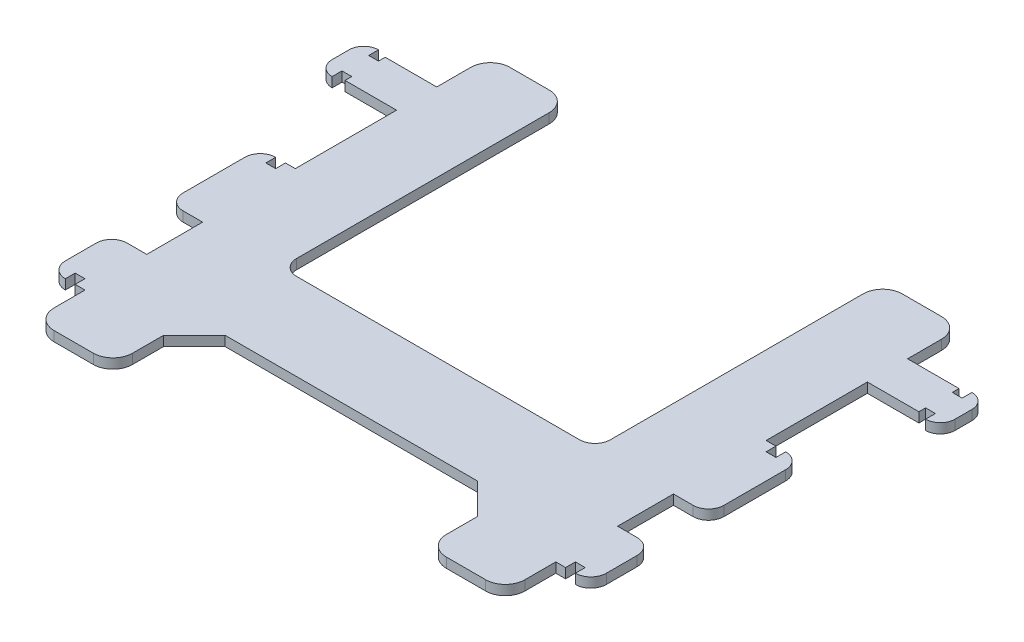
from build123d import *

# Parameters (mm, degrees)
SKETCH1_W           = 196.85
SKETCH1_H           = 120
BOSS_EXTRUDE1_DEPTH = 3.175
SKETCH2_W           = 152.4
SKETCH2_H           = 2.188710325
SKETCH2_W_2         = 3.175
SKETCH2_H_2         = 3.175
CUT_EXTRUDE3_DEPTH  = 3.175
BOSS_EXTRUDE3_DEPTH = 3.175
CUT_EXTRUDE5_DEPTH  = 6.175
BOSS_EXTRUDE4_DEPTH = 3.175
SKETCH8_W           = 16.66875
SKETCH8_H           = 1
CUT_EXTRUDE6_DEPTH  = 4
SKETCH9_W           = 16.66875
SKETCH9_H           = 1
CUT_EXTRUDE7_DEPTH  = 4


with BuildPart() as part:
    # Sketch1 → Boss-Extrude1 (new body)
    with BuildSketch(Plane(origin=(0, 0, 0), x_dir=(1, 0, 0), z_dir=(0, 1, 0))):
        Rectangle(SKETCH1_W, SKETCH1_H)
    extrude(amount=BOSS_EXTRUDE1_DEPTH)

    # Sketch2 → Cut-Extrude3 (cut)
    with BuildSketch(Plane(origin=(0, 0, 0), x_dir=(1, 0, 0), z_dir=(0, 1, 0))):
        with BuildLine():
            ThreePointArc((-87.55, -42.045183145), (-86.085533906, -38.509649239), (-82.55, -37.045183145))
            Line((-82.55, -37.045183145), (-98.425, -37.045183145))
            Line((-98.425, -37.045183145), (-98.425, -57.045183145))
            Line((-98.425, -57.045183145), (-82.55, -57.045183145))
            ThreePointArc((-82.55, -57.045183145), (-86.085533906, -55.580717051), (-87.55, -52.045183145))
            Line((-87.55, -52.045183145), (-87.55, -42.045183145))
        make_face()
        Polygon((-82.55, -37.045183145), (-76.2, -37.045183145), (-76.2, -18.966736095), (-82.55, -18.966736095), (-98.425, -18.966736095), (-98.425, -37.045183145), align=None)
        with BuildLine():
            Line((-98.425, -18.966736095), (-82.55, -18.966736095))
            ThreePointArc((-82.55, -18.966736095), (-86.085533906, -17.502270001), (-87.55, -13.966736095))
            Line((-87.55, -13.966736095), (-87.55, 6.033263905))
            ThreePointArc((-87.55, 6.033263905), (-86.085533906, 9.568797811), (-82.55, 11.033263905))
            Line((-82.55, 11.033263905), (-98.425, 11.033263905))
            Line((-98.425, 11.033263905), (-98.425, -18.966736095))
        make_face()
        with BuildLine():
            Line((-76.2, 11.033263905), (-76.2, 42.808053265))
            Line((-76.2, 42.808053265), (-92.86875, 42.808053265))
            Line((-92.86875, 42.808053265), (-96.04375, 42.808053265))
            ThreePointArc((-96.04375, 42.808053265), (-97.276375702, 42.970331517), (-98.425, 43.44610728))
            Line((-98.425, 43.44610728), (-98.425, 11.033263905))
            Line((-98.425, 11.033263905), (-82.55, 11.033263905))
            Line((-82.55, 11.033263905), (-79.375, 11.033263905))
            Line((-79.375, 11.033263905), (-76.2, 11.033263905))
        make_face()
        with BuildLine():
            Line((-92.86875, 57.811289675), (-76.2, 57.811289675))
            Line((-76.2, 57.811289675), (-76.2, 60))
            Line((-76.2, 60), (-98.425, 60))
            Line((-98.425, 60), (-98.425, 57.173235661))
            ThreePointArc((-98.425, 57.173235661), (-97.276375702, 57.649011423), (-96.04375, 57.811289675))
            Line((-96.04375, 57.811289675), (-92.86875, 57.811289675))
        make_face()
        with Locations((0, 58.905644838)):
            Rectangle(SKETCH2_W, SKETCH2_H)
        with BuildLine():
            Line((76.2, 60), (76.2, 57.811289675))
            Line((76.2, 57.811289675), (92.86875, 57.811289675))
            Line((92.86875, 57.811289675), (92.86875, 54.636289675))
            Line((92.86875, 54.636289675), (96.04375, 54.636289675))
            Line((96.04375, 54.636289675), (96.04375, 57.811289675))
            ThreePointArc((96.04375, 57.811289675), (97.276375702, 57.649011423), (98.425, 57.173235661))
            Line((98.425, 57.173235661), (98.425, 60))
            Line((98.425, 60), (76.2, 60))
        make_face()
        with BuildLine():
            Line((79.375, -18.966736095), (76.2, -18.966736095))
            Line((76.2, -18.966736095), (76.2, -37.045183145))
            Line((76.2, -37.045183145), (82.55, -37.045183145))
            ThreePointArc((82.55, -37.045183145), (86.085533906, -38.509649239), (87.55, -42.045183145))
            Line((87.55, -42.045183145), (87.55, -52.045183145))
            ThreePointArc((87.55, -52.045183145), (86.085533906, -55.580717051), (82.55, -57.045183145))
            Line((82.55, -57.045183145), (82.55, -53.870183145))
            Line((82.55, -53.870183145), (79.375, -53.870183145))
            Line((79.375, -53.870183145), (79.375, -57.045183145))
            Line((79.375, -57.045183145), (76.2, -57.045183145))
            Line((76.2, -57.045183145), (76.2, -59.23389347))
            Line((76.2, -59.23389347), (76.2, -60))
            Line((76.2, -60), (98.425, -60))
            Line((98.425, -60), (98.425, 0))
            Line((98.425, 0), (98.425, 43.44610728))
            ThreePointArc((98.425, 43.44610728), (97.276375702, 42.970331517), (96.04375, 42.808053265))
            Line((96.04375, 42.808053265), (96.04375, 45.983053265))
            Line((96.04375, 45.983053265), (92.86875, 45.983053265))
            Line((92.86875, 45.983053265), (92.86875, 42.808053265))
            Line((92.86875, 42.808053265), (87.3125, 42.808053265))
            Line((87.3125, 42.808053265), (76.2, 42.808053265))
            Line((76.2, 42.808053265), (76.2, 11.033263905))
            Line((76.2, 11.033263905), (79.375, 11.033263905))
            Line((79.375, 11.033263905), (79.375, 7.858263905))
            Line((79.375, 7.858263905), (82.55, 7.858263905))
            Line((82.55, 7.858263905), (82.55, 11.033263905))
            ThreePointArc((82.55, 11.033263905), (86.085533906, 9.568797811), (87.55, 6.033263905))
            Line((87.55, 6.033263905), (87.55, -13.966736095))
            ThreePointArc((87.55, -13.966736095), (86.085533906, -17.502270001), (82.55, -18.966736095))
            Line((82.55, -18.966736095), (79.375, -18.966736095))
        make_face()
        Polygon((76.2, -59.23389347), (76.2, -57.045183145), (-76.2, -57.045183145), (-76.2, -59.23389347), (-76.2, -60), (76.2, -60), align=None)
        Polygon((-76.2, -59.23389347), (-76.2, -57.045183145), (-79.375, -57.045183145), (-82.55, -57.045183145), (-98.425, -57.045183145), (-98.425, -60), (-76.2, -60), align=None)
        with Locations((-80.9625, -55.457683145)):
            Rectangle(SKETCH2_W_2, SKETCH2_H_2)
        with Locations((-80.9625, 9.445763905)):
            Rectangle(SKETCH2_W_2, SKETCH2_H_2)
        with Locations((-94.45625, 44.395553265)):
            Rectangle(SKETCH2_W_2, SKETCH2_H_2)
        with Locations((-94.45625, 56.223789675)):
            Rectangle(SKETCH2_W_2, SKETCH2_H_2)
    extrude(amount=CUT_EXTRUDE3_DEPTH, mode=Mode.SUBTRACT)

    # Sketch5 → Boss-Extrude3 (add)
    with BuildSketch(Plane(origin=(0, 0, 0), x_dir=(1, 0, 0), z_dir=(0, 1, 0))):
        with BuildLine():
            ThreePointArc((-98.425, 57.173235661), (-100.168195986, 55.430039675), (-100.80625, 53.048789675))
            Line((-100.80625, 53.048789675), (-100.80625, 47.570553265))
            ThreePointArc((-100.80625, 47.570553265), (-100.168195986, 45.189303265), (-98.425, 43.44610728))
            Line((-98.425, 43.44610728), (-98.425, 57.173235661))
        make_face()
        with BuildLine():
            ThreePointArc((100.80625, 53.048789675), (100.168195986, 55.430039675), (98.425, 57.173235661))
            Line((98.425, 57.173235661), (98.425, 43.44610728))
            ThreePointArc((98.425, 43.44610728), (100.168195986, 45.189303265), (100.80625, 47.570553265))
            Line((100.80625, 47.570553265), (100.80625, 53.048789675))
        make_face()
    extrude(amount=BOSS_EXTRUDE3_DEPTH)

    # Sketch6 → Cut-Extrude5 (cut)
    with BuildSketch(Plane(origin=(0, 0, 0), x_dir=(1, 0, 0), z_dir=(0, 1, 0))):
        with BuildLine():
            Line((-45.8, -18.966736095), (45.8, -18.966736095))
            ThreePointArc((45.8, -18.966736095), (49.335533906, -17.502270001), (50.8, -13.966736095))
            Line((50.8, -13.966736095), (50.8, 57.811289675))
            Line((50.8, 57.811289675), (-50.8, 57.811289675))
            Line((-50.8, 57.811289675), (-50.8, -13.966736095))
            ThreePointArc((-50.8, -13.966736095), (-49.335533906, -17.502270001), (-45.8, -18.966736095))
        make_face()
        Polygon((-50.8, -57.045183145), (-40.8, -47.045183145), (40.8, -47.045183145), (50.8, -57.045183145), align=None)
    extrude(amount=CUT_EXTRUDE5_DEPTH, mode=Mode.SUBTRACT)

    # Sketch7 → Boss-Extrude4 (add)
    with BuildSketch(Plane(origin=(0, 0, 0), x_dir=(1, 0, 0), z_dir=(0, 1, 0))):
        with BuildLine():
            Line((-50.8, 57.811289675), (-50.8, 67.811289675))
            ThreePointArc((-50.8, 67.811289675), (-52.659871939, 72.301417736), (-57.15, 74.161289675))
            Line((-57.15, 74.161289675), (-69.85, 74.161289675))
            ThreePointArc((-69.85, 74.161289675), (-74.340128061, 72.301417736), (-76.2, 67.811289675))
            Line((-76.2, 67.811289675), (-76.2, 57.811289675))
            Line((-76.2, 57.811289675), (-50.8, 57.811289675))
        make_face()
        with BuildLine():
            Line((76.2, 57.811289675), (76.2, 67.811289675))
            ThreePointArc((76.2, 67.811289675), (74.340128061, 72.301417736), (69.85, 74.161289675))
            Line((69.85, 74.161289675), (57.15, 74.161289675))
            ThreePointArc((57.15, 74.161289675), (52.659871939, 72.301417736), (50.8, 67.811289675))
            Line((50.8, 67.811289675), (50.8, 57.811289675))
            Line((50.8, 57.811289675), (76.2, 57.811289675))
        make_face()
        with BuildLine():
            ThreePointArc((-50.8, -67.045183145), (-52.659871939, -71.535311205), (-57.15, -73.395183145))
            Line((-57.15, -73.395183145), (-69.85, -73.395183145))
            ThreePointArc((-69.85, -73.395183145), (-74.340128061, -71.535311205), (-76.2, -67.045183145))
            Line((-76.2, -67.045183145), (-76.2, -57.045183145))
            Line((-76.2, -57.045183145), (-50.8, -57.045183145))
            Line((-50.8, -57.045183145), (-50.8, -67.045183145))
        make_face()
        with BuildLine():
            Line((50.8, -57.045183145), (50.8, -67.045183145))
            ThreePointArc((50.8, -67.045183145), (52.659871939, -71.535311205), (57.15, -73.395183145))
            Line((57.15, -73.395183145), (69.85, -73.395183145))
            ThreePointArc((69.85, -73.395183145), (74.340128061, -71.535311205), (76.2, -67.045183145))
            Line((76.2, -67.045183145), (76.2, -57.045183145))
            Line((76.2, -57.045183145), (50.8, -57.045183145))
        make_face()
    extrude(amount=BOSS_EXTRUDE4_DEPTH)

    # Sketch8 → Cut-Extrude6 (cut)
    with BuildSketch(Plane(origin=(0, 0, 0), x_dir=(1, 0, 0), z_dir=(0, 1, 0))):
        with Locations((84.534375, 43.308053265)):
            Rectangle(SKETCH8_W, SKETCH8_H)
        with Locations((84.534375, 57.311289675)):
            Rectangle(SKETCH8_W, SKETCH8_H)
    extrude(amount=CUT_EXTRUDE6_DEPTH, mode=Mode.SUBTRACT)

    # Sketch9 → Cut-Extrude7 (cut)
    with BuildSketch(Plane(origin=(0, 0, 0), x_dir=(1, 0, 0), z_dir=(0, 1, 0))):
        with Locations((-84.534375, 57.311289675)):
            Rectangle(SKETCH9_W, SKETCH9_H)
        with Locations((-84.534375, 43.308053265)):
            Rectangle(SKETCH9_W, SKETCH9_H)
    extrude(amount=CUT_EXTRUDE7_DEPTH, mode=Mode.SUBTRACT)


solid = part.part
